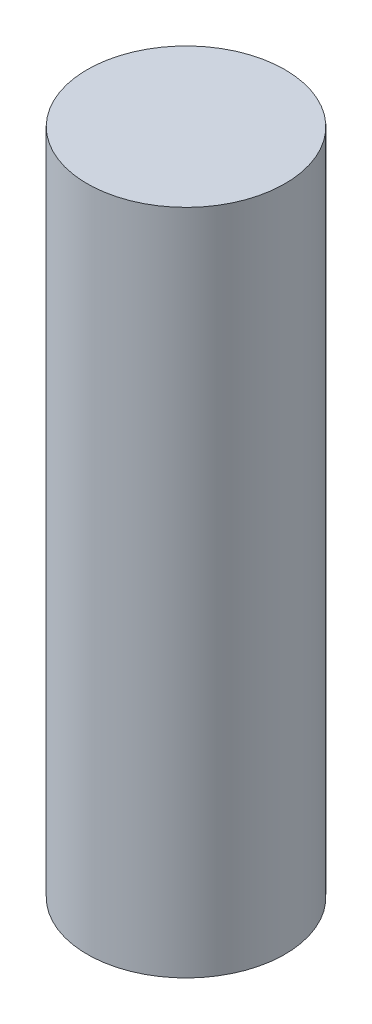
from build123d import *

# Parameters (mm, degrees)
SKETCH3_W = 2000
SKETCH3_H = 13500


with BuildPart() as part:
    # Sketch3 → Revolve1 (revolve)
    with BuildSketch(Plane.XY, mode=Mode.PRIVATE) as revolve1_sk:
        with Locations((1000, 6750)):
            Rectangle(SKETCH3_W, SKETCH3_H)
    revolve(revolve1_sk.sketch.rotate(Axis((0, -2658.356142116, 0), (0, 1, 0)), 90), axis=Axis((0, -2658.356142116, 0), (0, 1, 0)))


solid = part.part
